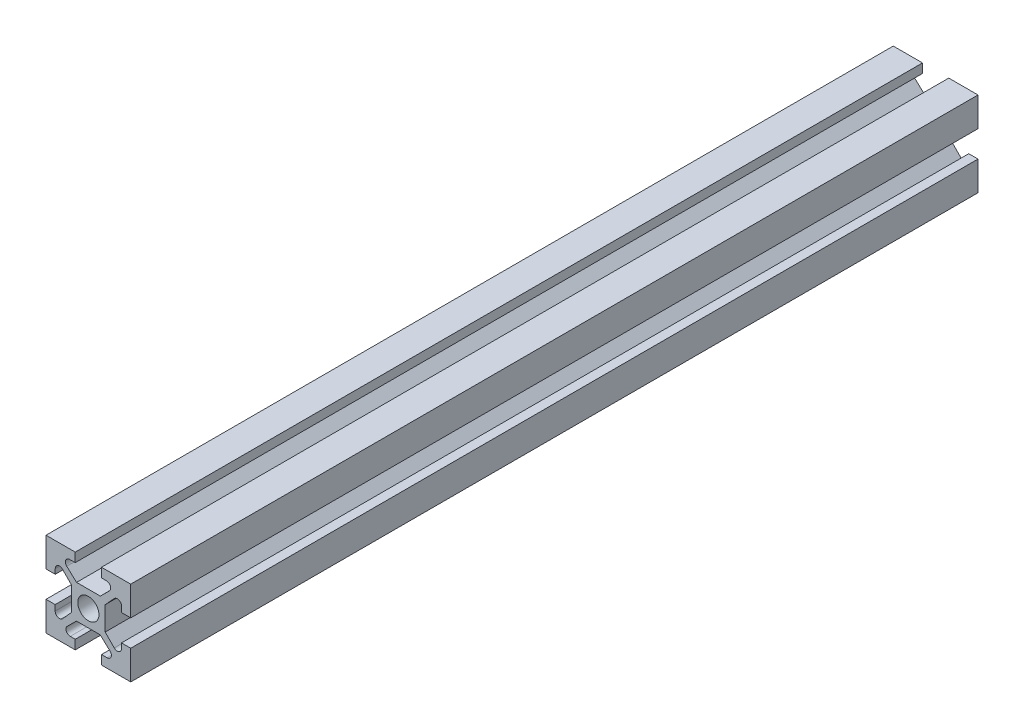
from build123d import *

# Parameters (mm, degrees)
SKETCH2_R           = 2.5
BOSS_EXTRUDE1_DEPTH = 200


with BuildPart() as part:
    # Sketch2 → Boss-Extrude1 (new body)
    with BuildSketch(Plane.XY):
        with BuildLine():
            Line((-10, -10), (-3.1, -10))
            Line((-3.1, -10), (-3.1, -7.81857447))
            Line((-3.1, -7.81857447), (-4.285374034, -7.81857447))
            ThreePointArc((-4.285374034, -7.81857447), (-5.210402021, -7.198473435), (-4.988208383, -6.107220917))
            Line((-4.988208383, -6.107220917), (-2.819718275, -3.96470075))
            Line((-2.819718275, -3.96470075), (0, -3.96470075))
            Line((0, -3.96470075), (2.782738033, -3.96470075))
            Line((2.782738033, -3.96470075), (5.105242131, -6.103332486))
            ThreePointArc((5.105242131, -6.103332486), (5.359419929, -7.202533996), (4.427854938, -7.838959152))
            Line((4.427854938, -7.838959152), (3.1, -7.838959152))
            Line((3.1, -7.838959152), (3.1, -10))
            Line((3.1, -10), (10, -10))
            Line((10, -10), (10, -3.1))
            Line((10, -3.1), (7.81857447, -3.1))
            Line((7.81857447, -3.1), (7.81857447, -4.285374034))
            ThreePointArc((7.81857447, -4.285374034), (7.198473435, -5.210402021), (6.107220917, -4.988208383))
            Line((6.107220917, -4.988208383), (3.96470075, -2.819718275))
            Line((3.96470075, -2.819718275), (3.96470075, 0))
            Line((3.96470075, 0), (3.96470075, 2.782738033))
            Line((3.96470075, 2.782738033), (6.103332486, 5.105242131))
            ThreePointArc((6.103332486, 5.105242131), (7.202533996, 5.359419929), (7.838959152, 4.427854938))
            Line((7.838959152, 4.427854938), (7.838959152, 3.1))
            Line((7.838959152, 3.1), (10, 3.1))
            Line((10, 3.1), (10, 10))
            Line((10, 10), (3.1, 10))
            Line((3.1, 10), (3.1, 7.81857447))
            Line((3.1, 7.81857447), (4.285374034, 7.81857447))
            ThreePointArc((4.285374034, 7.81857447), (5.210402021, 7.198473435), (4.988208383, 6.107220917))
            Line((4.988208383, 6.107220917), (2.819718275, 3.96470075))
            Line((2.819718275, 3.96470075), (0, 3.96470075))
            Line((0, 3.96470075), (-2.782738033, 3.96470075))
            Line((-2.782738033, 3.96470075), (-5.105242131, 6.103332486))
            ThreePointArc((-5.105242131, 6.103332486), (-5.359419929, 7.202533996), (-4.427854938, 7.838959152))
            Line((-4.427854938, 7.838959152), (-3.1, 7.838959152))
            Line((-3.1, 7.838959152), (-3.1, 10))
            Line((-3.1, 10), (-10, 10))
            Line((-10, 10), (-10, 3.1))
            Line((-10, 3.1), (-7.81857447, 3.1))
            Line((-7.81857447, 3.1), (-7.81857447, 4.285374034))
            ThreePointArc((-7.81857447, 4.285374034), (-7.198473435, 5.210402021), (-6.107220917, 4.988208383))
            Line((-6.107220917, 4.988208383), (-3.96470075, 2.819718275))
            Line((-3.96470075, 2.819718275), (-3.96470075, 0))
            Line((-3.96470075, 0), (-3.96470075, -2.782738033))
            Line((-3.96470075, -2.782738033), (-6.103332486, -5.105242131))
            ThreePointArc((-6.103332486, -5.105242131), (-7.202533996, -5.359419929), (-7.838959152, -4.427854938))
            Line((-7.838959152, -4.427854938), (-7.838959152, -3.1))
            Line((-7.838959152, -3.1), (-10, -3.1))
            Line((-10, -3.1), (-10, -10))
        make_face()
        Circle(SKETCH2_R, mode=Mode.SUBTRACT)
    extrude(amount=BOSS_EXTRUDE1_DEPTH)


solid = part.part
